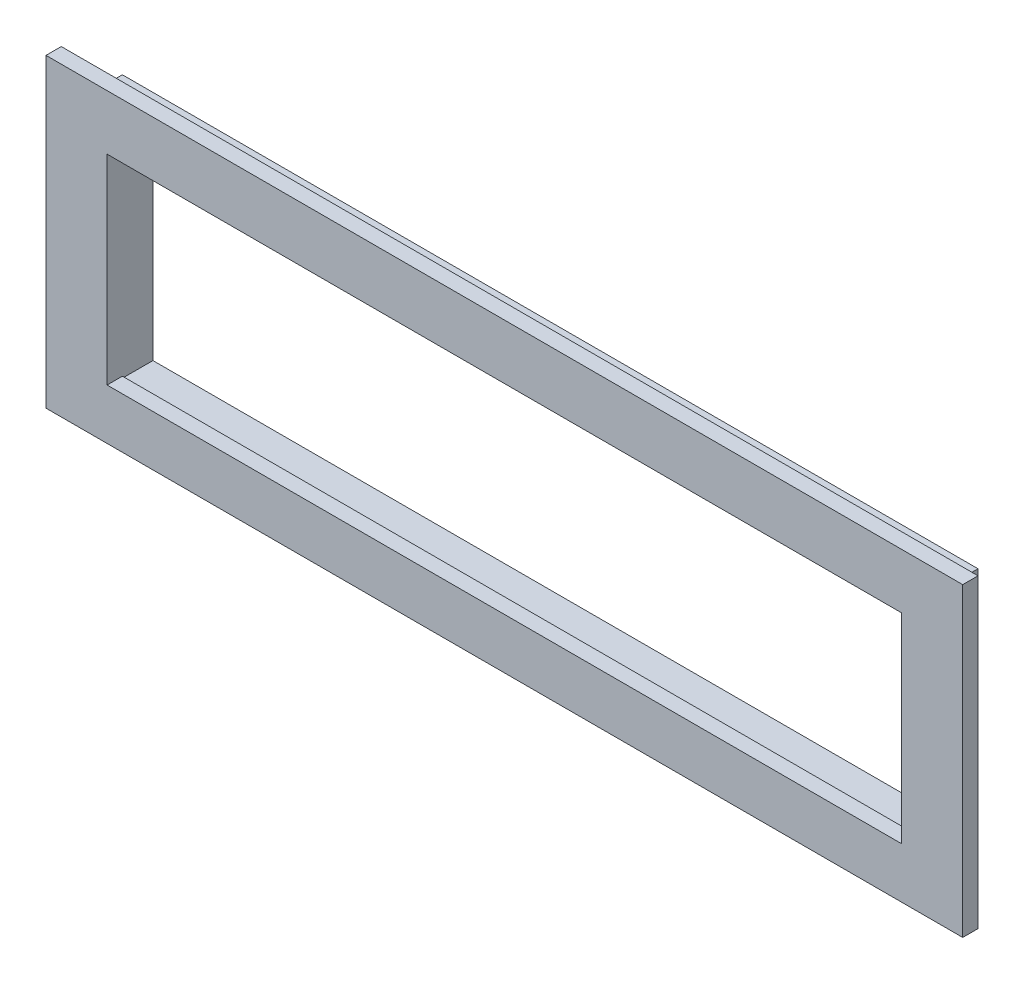
from build123d import *

# Parameters (mm, degrees)
SKETCH_1_W      = 28
SKETCH_1_H      = 8.6
SKETCH_1_W_2    = 26
SKETCH_1_H_2    = 6.6
EXTRUDE_1_DEPTH = 1
SKETCH_2_W      = 30
SKETCH_2_H      = 10
SKETCH_2_W_2    = 26
SKETCH_2_H_2    = 6.54302186
EXTRUDE_2_DEPTH = 0.5


with BuildPart() as part:
    # Эскиз1 → Бобышка-Вытянуть1 (new body)
    with BuildSketch(Plane.XY):
        with Locations((-21.588376798, -20.389004385)):
            Rectangle(SKETCH_1_W, SKETCH_1_H)
        with Locations((-21.588376798, -20.389004385)):
            Rectangle(SKETCH_1_W_2, SKETCH_1_H_2, mode=Mode.SUBTRACT)
    extrude(amount=-EXTRUDE_1_DEPTH)

    # Эскиз2 → Бобышка-Вытянуть2 (add)
    with BuildSketch(Plane.XY):
        with Locations((-21.588376798, -20.289004385)):
            Rectangle(SKETCH_2_W, SKETCH_2_H)
        with Locations((-21.588376798, -20.360515315)):
            Rectangle(SKETCH_2_W_2, SKETCH_2_H_2, mode=Mode.SUBTRACT)
    extrude(amount=EXTRUDE_2_DEPTH)


solid = part.part
